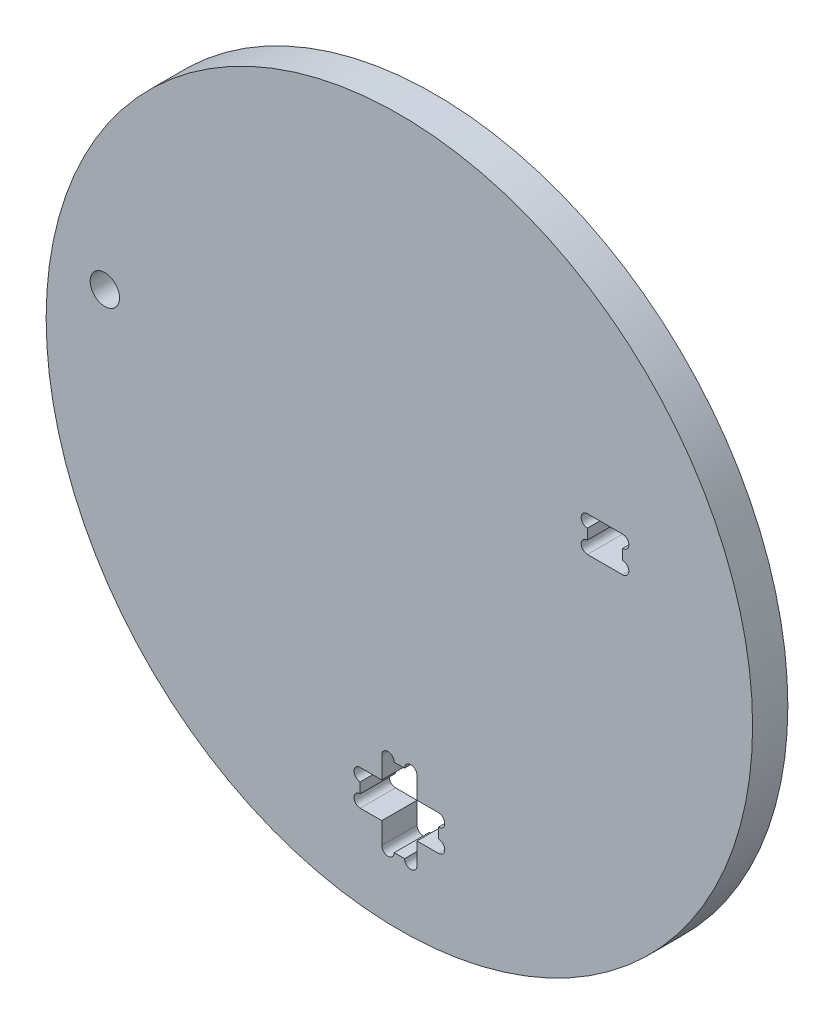
from build123d import *

# Parameters (mm, degrees)
SCHIZZO1_R                   = 180.415
ESTRUSIONE_ESTRUSIONE1_DEPTH = 18
TAGLIO_ESTRUSIONE1_DEPTH     = 48
SCHIZZO1_18_R                = 7.5
TAGLIO_ESTRUSIONE2_DEPTH     = 80
TAGLIO_ESTRUSIONE3_DEPTH     = 135


with BuildPart() as part:
    # Schizzo1 → Estrusione-Estrusione1 (new body)
    with BuildSketch(Plane.XY):
        with Locations((-69.647392192, -18.728644796)):
            Circle(SCHIZZO1_R)
    extrude(amount=ESTRUSIONE_ESTRUSIONE1_DEPTH)

    # Schizzo1<17> → Taglio-Estrusione1 (cut)
    with BuildSketch(Plane.XY):
        with BuildLine():
            Line((44.382329363, 15.018559966), (26.382329363, 15.018559966))
            ThreePointArc((26.382329363, 15.018559966), (23.207329363, 18.193559966), (26.382329363, 21.368559966))
            Line((26.382329363, 21.368559966), (26.382329363, 26.668559966))
            ThreePointArc((26.382329363, 26.668559966), (23.207329363, 29.843559966), (26.382329363, 33.018559966))
            Line((26.382329363, 33.018559966), (44.382329363, 33.018559966))
            ThreePointArc((44.382329363, 33.018559966), (47.557329363, 29.843559966), (44.382329363, 26.668559966))
            Line((44.382329363, 26.668559966), (44.382329363, 21.368559966))
            ThreePointArc((44.382329363, 21.368559966), (47.557329363, 18.193559966), (44.382329363, 15.018559966))
        make_face()
    extrude(amount=TAGLIO_ESTRUSIONE1_DEPTH, mode=Mode.SUBTRACT)

    # Schizzo1<18> → Taglio-Estrusione2 (cut)
    with BuildSketch(Plane.XY):
        with Locations((-220.074947502, 8.955026171)):
            Circle(SCHIZZO1_18_R)
    extrude(amount=TAGLIO_ESTRUSIONE2_DEPTH, mode=Mode.SUBTRACT)

    # Schizzo1<19> → Taglio-Estrusione3 (cut)
    with BuildSketch(Plane.XY):
        with BuildLine():
            Line((-66.997392192, -126.234256826), (-72.297392192, -126.234256826))
            ThreePointArc((-72.297392192, -126.234256826), (-75.472392192, -123.059256826), (-78.647392192, -126.234256826))
            Line((-78.647392192, -126.234256826), (-78.647392192, -137.234256826))
            Line((-78.647392192, -137.234256826), (-89.647392192, -137.234256826))
            ThreePointArc((-89.647392192, -137.234256826), (-92.822392192, -140.409256826), (-89.647392192, -143.584256826))
            Line((-89.647392192, -143.584256826), (-89.647392192, -148.884256826))
            ThreePointArc((-89.647392192, -148.884256826), (-92.822392192, -152.059256826), (-89.647392192, -155.234256826))
            Line((-89.647392192, -155.234256826), (-78.647392192, -155.234256826))
            Line((-78.647392192, -155.234256826), (-78.647392192, -166.234256826))
            ThreePointArc((-78.647392192, -166.234256826), (-75.472392192, -169.409256826), (-72.297392192, -166.234256826))
            Line((-72.297392192, -166.234256826), (-66.997392192, -166.234256826))
            ThreePointArc((-66.997392192, -166.234256826), (-63.822392192, -169.409256826), (-60.647392192, -166.234256826))
            Line((-60.647392192, -166.234256826), (-60.647392192, -155.234256826))
            Line((-60.647392192, -155.234256826), (-49.647392192, -155.234256826))
            ThreePointArc((-49.647392192, -155.234256826), (-46.472392192, -152.059256826), (-49.647392192, -148.884256826))
            Line((-49.647392192, -148.884256826), (-49.647392192, -143.584256826))
            ThreePointArc((-49.647392192, -143.584256826), (-46.472392192, -140.409256826), (-49.647392192, -137.234256826))
            Line((-49.647392192, -137.234256826), (-60.647392192, -137.234256826))
            Line((-60.647392192, -137.234256826), (-60.647392192, -126.234256826))
            ThreePointArc((-60.647392192, -126.234256826), (-63.822392192, -123.059256826), (-66.997392192, -126.234256826))
        make_face()
    extrude(amount=TAGLIO_ESTRUSIONE3_DEPTH, mode=Mode.SUBTRACT)


solid = part.part
